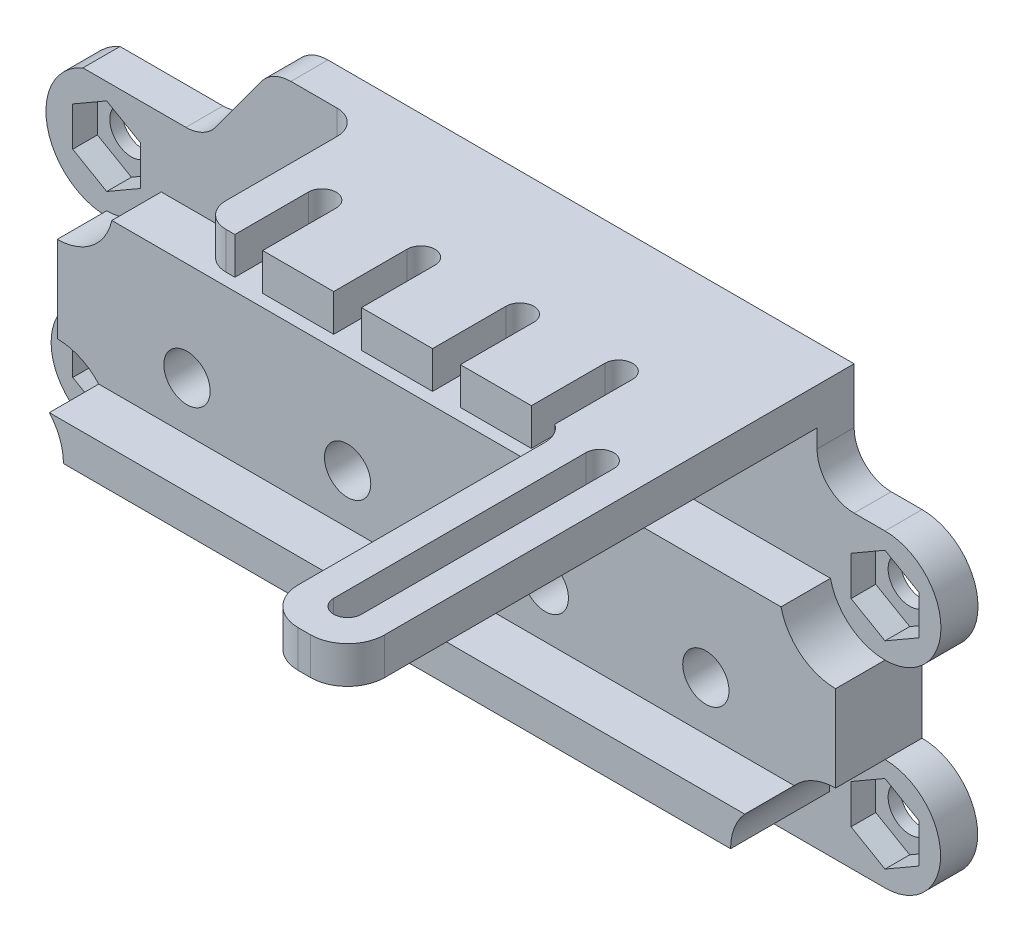
from build123d import *

# Parameters (mm, degrees)
ESQUISSE1_R             = 1.749999998
BOSS_EXTRU_1_DEPTH      = 3
ENL_V_MAT_EXTRU_1_DEPTH = 2
ESQUISSE3_W             = 63
ESQUISSE3_H             = 15
BOSS_EXTRU_2_DEPTH      = 4
ESQUISSE5_W             = 63
ESQUISSE5_H             = 3
BOSS_EXTRU_3_DEPTH      = 4
ESQUISSE4_R             = 4.499999998
ESQUISSE4_R_2           = 4.527692567
ENL_V_MAT_EXTRU_2_DEPTH = 41.723100164
ESQUISSE6_R             = 1.875
ENL_V_MAT_EXTRU_4_DEPTH = 41.538511158
ENL_V_MAT_EXTRU_5_DEPTH = 4
ESQUISSE8_W             = 36.859122618
ESQUISSE8_H             = 3
BOSS_EXTRU_4_DEPTH      = 13
CONG_1_R                = 3
ESQUISSE9_W             = 7
ESQUISSE9_H             = 3
BOSS_EXTRU_5_DEPTH      = 25
CONG_2_R                = 3
CONG_3_R                = 2
CONG_4_R                = 2
ENL_V_MAT_EXTRU_6_DEPTH = 63.211313789


with BuildPart() as part:
    # Esquisse1 → Boss.-Extru.1 (new body)
    with BuildSketch(Plane.XY):
        with BuildLine():
            Line((-33.132757167, 9.120273973), (-23.272060479, 9.120273973))
            Line((-23.272060479, 9.120273973), (-17.824378499, 16.590273973))
            Line((-17.824378499, 16.590273973), (26.292187613, 16.590273973))
            Line((26.292187613, 16.590273973), (26.292187613, 9.120273973))
            Line((26.292187613, 9.120273973), (31.792187613, 9.120273973))
            ThreePointArc((31.792187613, 9.120273973), (36.319880182, 4.592581404), (31.792187613, 0.064888835))
            Line((31.792187613, 0.064888835), (31.792187613, -6.907418596))
            ThreePointArc((31.792187613, -6.907418596), (36.292187613, -11.407418596), (31.792187613, -15.907418596))
            Line((31.792187613, -15.907418596), (-31.207812389, -15.907418596))
            ThreePointArc((-31.207812389, -15.907418596), (-35.707812387, -11.407418595), (-31.207812387, -6.907418596))
            Line((-31.207812387, -6.907418596), (-31.207812387, -0.327318229))
            ThreePointArc((-31.207812387, -0.327318229), (-36.028663215, 3.610334136), (-33.132757167, 9.120273973))
        make_face()
        with Locations((-31.207812387, 4.592581404)):
            Circle(ESQUISSE1_R, mode=Mode.SUBTRACT)
        with Locations((-31.207812387, -11.407418596)):
            Circle(ESQUISSE1_R, mode=Mode.SUBTRACT)
        with Locations((31.792187613, 4.592581404)):
            Circle(ESQUISSE1_R, mode=Mode.SUBTRACT)
        with Locations((31.792187613, -11.407418596)):
            Circle(ESQUISSE1_R, mode=Mode.SUBTRACT)
    extrude(amount=BOSS_EXTRU_1_DEPTH)

    # Esquisse2 → Enlèv. mat.-Extru.1 (cut)
    with BuildSketch(Plane.XY.offset(3)):
        Polygon((-28.457812387, 6.180294644), (-31.207812387, 7.768007885), (-33.957812387, 6.180294644), (-33.957812387, 3.004868164), (-31.207812387, 1.417154924), (-28.457812387, 3.004868164), align=None)
        Polygon((-28.457812387, -9.819705356), (-31.207812387, -8.231992115), (-33.957812387, -9.819705356), (-33.957812387, -12.995131836), (-31.207812387, -14.582845076), (-28.457812387, -12.995131836), align=None)
        Polygon((29.042187613, -9.819705356), (29.042187613, -12.995131836), (31.792187613, -14.582845076), (34.542187613, -12.995131836), (34.542187613, -9.819705356), (31.792187613, -8.231992115), align=None)
        Polygon((29.042187613, 3.004868164), (31.792187613, 1.417154924), (34.542187613, 3.004868164), (34.542187613, 6.180294644), (31.792187613, 7.768007885), (29.042187613, 6.180294644), align=None)
    extrude(amount=-ENL_V_MAT_EXTRU_1_DEPTH, mode=Mode.SUBTRACT)

    # Esquisse3 → Boss.-Extru.2 (add)
    with BuildSketch(Plane.XY.offset(3)):
        with Locations((0.292187613, -3.907418596)):
            Rectangle(ESQUISSE3_W, ESQUISSE3_H)
    extrude(amount=BOSS_EXTRU_2_DEPTH)

    # Esquisse5 → Boss.-Extru.3 (add)
    with BuildSketch(Plane.XY.offset(7)):
        with Locations((0.292187613, -9.907418596)):
            Rectangle(ESQUISSE5_W, ESQUISSE5_H)
    extrude(amount=BOSS_EXTRU_3_DEPTH)

    # Esquisse4 → Enlèv. mat.-Extru.2 (cut, through all)
    with BuildSketch(Plane.XY.offset(3)):
        with Locations((-31.207812387, -11.407418596)):
            Circle(ESQUISSE4_R)
        with Locations((31.792187613, -11.407418596)):
            Circle(ESQUISSE4_R)
        with Locations((-31.207812387, 4.592581404)):
            Circle(ESQUISSE4_R_2)
        with Locations((31.792187613, 4.592581404)):
            Circle(ESQUISSE4_R_2)
    extrude(amount=ENL_V_MAT_EXTRU_2_DEPTH, mode=Mode.SUBTRACT)

    # Esquisse6 → Enlèv. mat.-Extru.4 (cut, through all)
    with BuildSketch(Plane.XY.offset(7)):
        with Locations((-20.707812387, -4.407418596)):
            Circle(ESQUISSE6_R)
        with Locations((-7.707812387, -4.407418596)):
            Circle(ESQUISSE6_R)
    enl_v_mat_extru_4 = extrude(amount=-ENL_V_MAT_EXTRU_4_DEPTH, mode=Mode.SUBTRACT)

    # Esquisse7 → Enlèv. mat.-Extru.5 (cut)
    with BuildSketch(Plane(origin=(0, 0, 0), x_dir=(-1, 0, 0), z_dir=(0, 0, -1))):
        Polygon((23.457812387, -2.819705356), (20.707812387, -1.231992115), (17.957812387, -2.819705356), (17.957812387, -5.995131836), (20.707812387, -7.582845076), (23.457812387, -5.995131836), align=None)
        Polygon((10.457812387, -2.819705356), (7.707812387, -1.231992115), (4.957812387, -2.819705356), (4.957812387, -5.995131836), (7.707812387, -7.582845076), (10.457812387, -5.995131836), align=None)
    enl_v_mat_extru_5 = extrude(amount=-ENL_V_MAT_EXTRU_5_DEPTH, mode=Mode.SUBTRACT)

    # Symétrie1: Enlèv. mat.-Extru.4, Enlèv. mat.-Extru.5 across plane
    add(enl_v_mat_extru_4.mirror(Plane(origin=(0.292187613, 0, 0), x_dir=(0, 0, 1), z_dir=(1, 0, 0))), mode=Mode.SUBTRACT)
    add(enl_v_mat_extru_5.mirror(Plane(origin=(0.292187613, 0, 0), x_dir=(0, 0, 1), z_dir=(1, 0, 0))), mode=Mode.SUBTRACT)

    # Esquisse8 → Boss.-Extru.4 (add)
    with BuildSketch(Plane.XY.offset(3)):
        with Locations((7.862626304, 15.090273973)):
            Rectangle(ESQUISSE8_W, ESQUISSE8_H)
    extrude(amount=BOSS_EXTRU_4_DEPTH)

    # Congé1
    cong_1_edges = [part.edges().sort_by_distance(p)[0] for p in [
        (-23.272060479, 9.120273973, 1.5),
        (-17.824378499, 16.590273973, 1.5),
        (26.292187613, 9.120273973, 1.5),
    ]]
    fillet(cong_1_edges, radius=CONG_1_R)

    # Esquisse9 → Boss.-Extru.5 (add)
    with BuildSketch(Plane.XY.offset(16)):
        with Locations((22.792187613, 15.090273973)):
            Rectangle(ESQUISSE9_W, ESQUISSE9_H)
    extrude(amount=BOSS_EXTRU_5_DEPTH)

    # Congé2
    cong_2_edges = [part.edges().sort_by_distance(p)[0] for p in [
        (19.292187613, 15.090273973, 41),
        (26.292187613, 15.090273973, 41),
    ]]
    fillet(cong_2_edges, radius=CONG_2_R)

    # Congé3
    cong_3_edges = [part.edges().sort_by_distance(p)[0] for p in [
        (19.292187613, 15.090273973, 16),
    ]]
    fillet(cong_3_edges, radius=CONG_3_R)

    # Congé4
    cong_4_edges = [part.edges().sort_by_distance(p)[0] for p in [
        (-10.566935005, 15.090273973, 3),
        (-10.566935005, 15.090273973, 16),
    ]]
    fillet(cong_4_edges, radius=CONG_4_R)

    # Esquisse10 → Enlèv. mat.-Extru.6 (cut, through all)
    with BuildSketch(Plane.XZ.offset(-13.590273973)):
        with BuildLine():
            Line((23.917187613, 37.5), (23.917187613, 17.088453941))
            ThreePointArc((23.917187613, 17.088453941), (22.792187613, 15.963453941), (21.667187613, 17.088453941))
            Line((21.667187613, 17.088453941), (21.667187613, 37.5))
            ThreePointArc((21.667187613, 37.5), (22.792187613, 38.625), (23.917187613, 37.5))
        make_face()
        with BuildLine():
            Line((18.417187613, 23.212933961), (18.417187613, 10.058154515))
            ThreePointArc((18.417187613, 10.058154515), (17.292187613, 8.933154515), (16.167187613, 10.058154515))
            Line((16.167187613, 10.058154515), (16.167187613, 23.212933961))
            ThreePointArc((16.167187613, 23.212933961), (17.292187613, 24.337933961), (18.417187613, 23.212933961))
        make_face()
        with BuildLine():
            Line((10.417187613, 23.212933961), (10.417187613, 10.058154515))
            ThreePointArc((10.417187613, 10.058154515), (9.292187613, 8.933154515), (8.167187613, 10.058154515))
            Line((8.167187613, 10.058154515), (8.167187613, 23.212933961))
            ThreePointArc((8.167187613, 23.212933961), (9.292187613, 24.337933961), (10.417187613, 23.212933961))
        make_face()
        with BuildLine():
            Line((2.417187613, 23.212933961), (2.417187613, 10.058154515))
            ThreePointArc((2.417187613, 10.058154515), (1.292187613, 8.933154515), (0.167187613, 10.058154515))
            Line((0.167187613, 10.058154515), (0.167187613, 23.212933961))
            ThreePointArc((0.167187613, 23.212933961), (1.292187613, 24.337933961), (2.417187613, 23.212933961))
        make_face()
        with BuildLine():
            Line((-5.582812387, 23.212933961), (-5.582812387, 10.058154515))
            ThreePointArc((-5.582812387, 10.058154515), (-6.707812387, 8.933154515), (-7.832812387, 10.058154515))
            Line((-7.832812387, 10.058154515), (-7.832812387, 23.212933961))
            ThreePointArc((-7.832812387, 23.212933961), (-6.707812387, 24.337933961), (-5.582812387, 23.212933961))
        make_face()
    extrude(amount=-ENL_V_MAT_EXTRU_6_DEPTH, mode=Mode.SUBTRACT)


solid = part.part
